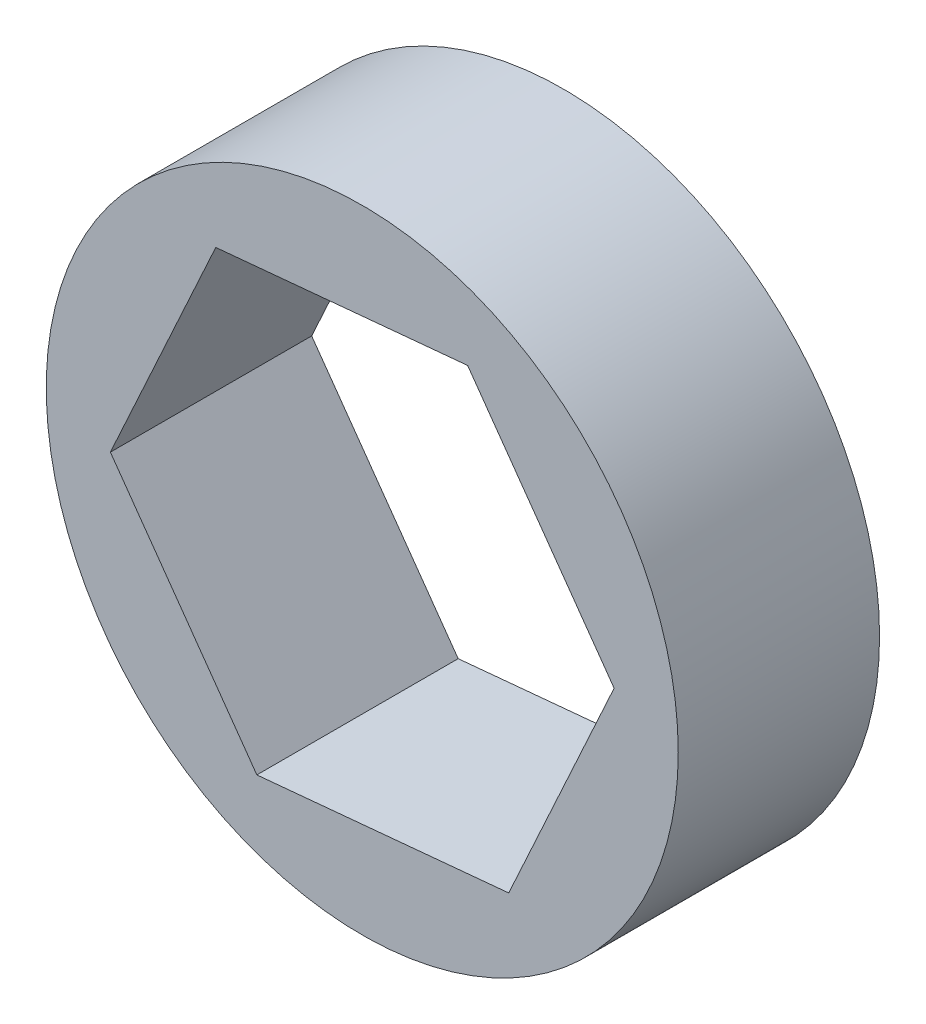
from build123d import *

# Parameters (mm, degrees)
SKETCH1_R           = 9.525
BOSS_EXTRUDE1_DEPTH = 6.06806


with BuildPart() as part:
    # Sketch1 → Boss-Extrude1 (new body)
    with BuildSketch(Plane.XY):
        Circle(SKETCH1_R)
        Polygon((-4.415250563, 6.21739365), (-7.592046128, -0.715022327), (-3.176795565, -6.932415977), (4.415250563, -6.21739365), (7.592046128, 0.715022327), (3.176795565, 6.932415977), align=None, mode=Mode.SUBTRACT)
    extrude(amount=BOSS_EXTRUDE1_DEPTH)


solid = part.part
